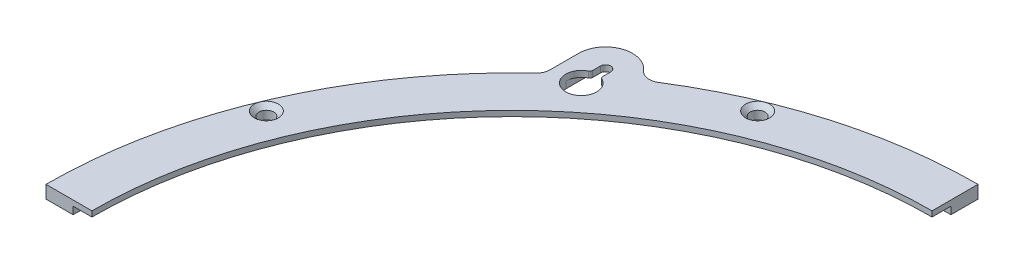
from build123d import *

# Parameters (mm, degrees)
CUT_EXTRUDE2_DEPTH                   = 25.4
F_6_0_204_DIAMETER_HOLE1_D           = 5.499999922
F_6_0_204_DIAMETER_HOLE1_CSINK_D     = 8.89
F_6_0_204_DIAMETER_HOLE1_CSINK_ANGLE = 90
BOSS_EXTRUDE2_REACH                  = 245.998
CUT_EXTRUDE3_DEPTH                   = 244.998078886
CUT_EXTRUDE4_DEPTH                   = 2.5
FILLET1_R                            = 5
FILLET3_R                            = 1


with BuildPart() as part:
    # Sketch1 → Revolve1 (revolve)
    with BuildSketch(Plane.XY, mode=Mode.PRIVATE) as revolve1_sk:
        Polygon((-162.5, 0), (-162.5, 2.75), (-155.5, 2.75), (-155.5, 4.75), (-172.5, 4.75), (-172.5, 0), align=None)
    revolve(revolve1_sk.sketch.rotate(Axis((0, 0, 0), (0, 1, 0)), 270), axis=Axis((0, 0, 0), (0, 1, 0)))

    # Sketch5 → Cut-Extrude2 (cut, symmetric)
    with BuildSketch(Plane(origin=(0, 0, 0), x_dir=(1, 0, 0), z_dir=(0, 1, 0))):
        with BuildLine():
            Line((0, 0), (0, 184.517203458))
            ThreePointArc((0, 184.517203458), (-130.473365811, -130.473365811), (184.517203458, 0))
            Line((184.517203458, 0), (0, 0))
        make_face()
    extrude(amount=CUT_EXTRUDE2_DEPTH, both=True, mode=Mode.SUBTRACT)

    # #6 (0.204) Diameter Hole1 (through all)
    with Locations(Plane(origin=(0, 4.75, 0), x_dir=(1, 0, 0), z_dir=(0, 1, 0))):
        with Locations((155.211761462, 64.290816637), (64.290816637, 155.211761462)):
            CounterSinkHole(F_6_0_204_DIAMETER_HOLE1_D / 2, F_6_0_204_DIAMETER_HOLE1_CSINK_D / 2, counter_sink_angle=F_6_0_204_DIAMETER_HOLE1_CSINK_ANGLE)

    # Boss-Extrude2: up to this face of the body (flat: up to its plane)
    boss_extrude2_end = Plane(part.part.faces().sort_by_distance((111.680104475, 4.75, -111.680104475))[0])
    # Sketch13 → Boss-Extrude2 (add, up to the picked face)
    with BuildSketch(Plane(origin=(0, 0, 0), x_dir=(1, 0, 0), z_dir=(0, 1, 0)), mode=Mode.PRIVATE) as boss_extrude2_sk1:
        with BuildLine():
            Line((115.914175626, 113.837772395), (115.914175626, 140.5528583))
            ThreePointArc((115.914175626, 140.5528583), (105.914175626, 150.5528583), (95.914175626, 140.5528583))
            Line((95.914175626, 140.5528583), (95.914175626, 135.636049675))
            Line((95.914175626, 135.636049675), (115.914175626, 113.837772395))
        make_face()
    boss_extrude2_tool1 = split(extrude(boss_extrude2_sk1.sketch, amount=BOSS_EXTRUDE2_REACH, mode=Mode.PRIVATE), bisect_by=boss_extrude2_end, keep=Keep.BOTH, mode=Mode.PRIVATE)
    add(boss_extrude2_tool1.solids().sort_by(Axis((107.449054, 0, -135.840664), (0, 1, 0)))[0])

    # Sketch8 → Cut-Extrude3 (cut, through all)
    with BuildSketch(Plane.XZ):
        with BuildLine():
            Line((104.009175626, -136.941011973), (104.009175626, -140.5528583))
            ThreePointArc((104.009175626, -140.5528583), (105.914175626, -142.4578583), (107.819175626, -140.5528583))
            Line((107.819175626, -140.5528583), (107.819175626, -136.941011973))
            ThreePointArc((107.819175626, -136.941011973), (105.914175626, -125.8378583), (104.009175626, -136.941011973))
        make_face()
    extrude(amount=-CUT_EXTRUDE3_DEPTH, mode=Mode.SUBTRACT)

    # Sketch9 → Cut-Extrude4 (cut)
    with BuildSketch(Plane.XZ):
        with BuildLine():
            Line((111.629175626, -140.5528583), (111.629175626, -131.5528583))
            ThreePointArc((111.629175626, -131.5528583), (105.914175626, -125.8378583), (100.199175626, -131.5528583))
            Line((100.199175626, -131.5528583), (100.199175626, -140.5528583))
            ThreePointArc((100.199175626, -140.5528583), (105.914175626, -146.2678583), (111.629175626, -140.5528583))
        make_face()
    extrude(amount=-CUT_EXTRUDE4_DEPTH, mode=Mode.SUBTRACT)

    # Fillet1
    fillet1_edges = [part.edges().sort_by_distance(p)[0] for p in [
        (115.914175626, 2.375, -127.750357687),
        (96.256410587, 2.375, -143.146615122),
    ]]
    fillet(fillet1_edges, radius=FILLET1_R)


with BuildPart() as body_2:
    # Mirror1: mirrored copy
    add(part.part.mirror(Plane(origin=(0, 0, 0), x_dir=(0, 0, 1), z_dir=(1, 0, 0))))

    # Fillet3
    fillet3_edges = [body_2.edges().sort_by_distance(p)[0] for p in [
        (-104.009175626, 3.625, -136.941011973),
        (-107.819175626, 3.625, -136.941011973),
    ]]
    fillet(fillet3_edges, radius=FILLET3_R)


solid = body_2.part
